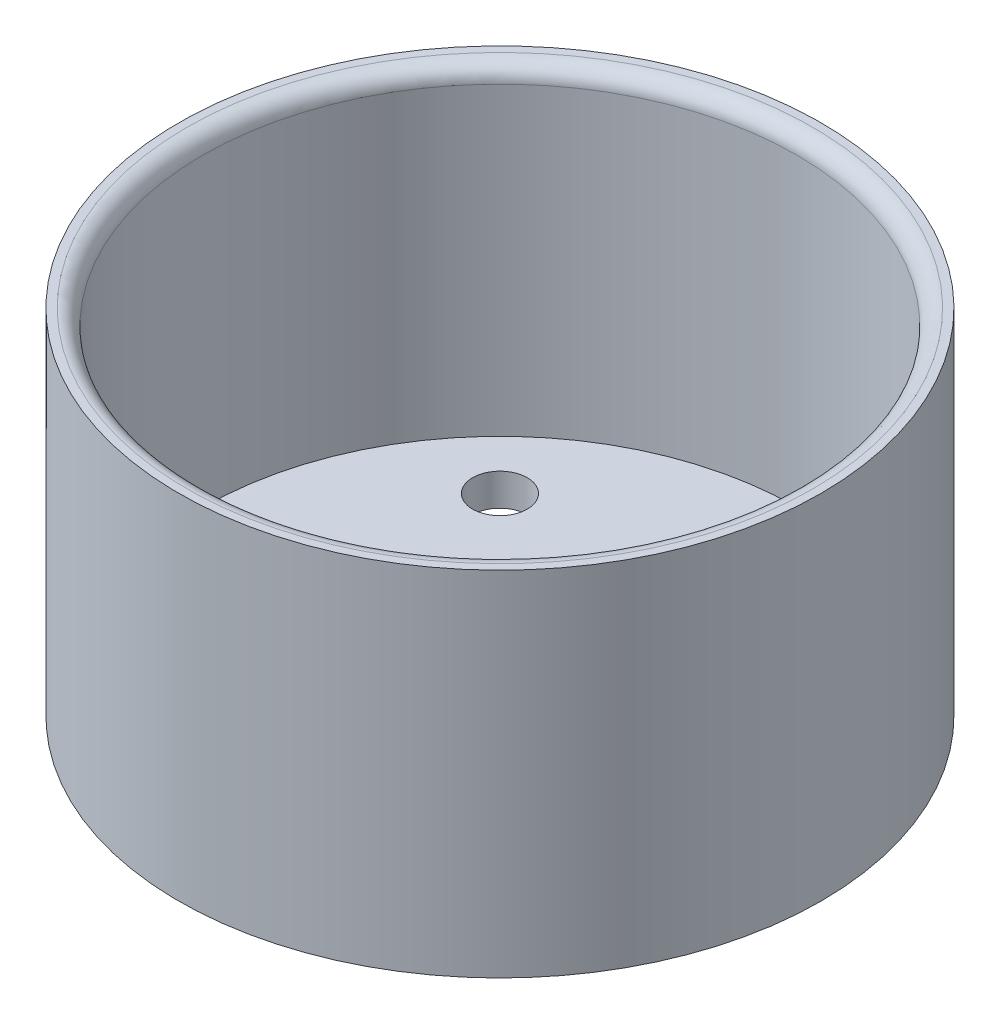
from build123d import *

# Parameters (mm, degrees)
CUT_EXTRUDE_1_DEPTH = 10


with BuildPart() as part:
    # 草图3 → 旋转1 (revolve)
    with BuildSketch(Plane.XY):
        with BuildLine():
            Line((0, 0), (0, 2))
            Line((0, 2), (18.5, 2))
            Line((18.5, 2), (18.5, 21))
            ThreePointArc((18.5, 21), (18.792893219, 21.707106781), (19.5, 22))
            Line((19.5, 22), (20, 22))
            Line((20, 22), (20, 2))
            Line((20, 2), (20, 1))
            Line((20, 1), (20, 0))
            Line((20, 0), (0, 0))
        make_face()
    revolve(axis=Axis((0, 0, 0), (0, 1, 0)))

    # 草图4 → 切除-拉伸1 (cut)
    with BuildSketch(Plane(origin=(0, 2, 0), x_dir=(1, 0, 0), z_dir=(0, 1, 0))):
        with BuildLine():
            ThreePointArc((10, -8.3), (8.797918472, -8.797918472), (8.3, -10))
            Line((8.3, -10), (10, -10))
            Line((10, -10), (10, -8.3))
        make_face()
        with BuildLine():
            Line((10, -10), (8.3, -10))
            ThreePointArc((8.3, -10), (10, -11.7), (11.7, -10))
            ThreePointArc((11.7, -10), (11.202081528, -8.797918472), (10, -8.3))
            Line((10, -8.3), (10, -10))
        make_face()
        with BuildLine():
            ThreePointArc((-10, -8.3), (-11.202081528, -11.202081528), (-8.3, -10))
            Line((-8.3, -10), (-10, -10))
            Line((-10, -10), (-10, -8.3))
        make_face()
        with BuildLine():
            Line((-10, -10), (-8.3, -10))
            ThreePointArc((-8.3, -10), (-8.797918472, -8.797918472), (-10, -8.3))
            Line((-10, -8.3), (-10, -10))
        make_face()
        with BuildLine():
            ThreePointArc((-8.3, 10), (-11.202081528, 11.202081528), (-10, 8.3))
            Line((-10, 8.3), (-10, 10))
            Line((-10, 10), (-8.3, 10))
        make_face()
        with BuildLine():
            Line((-10, 10), (-10, 8.3))
            ThreePointArc((-10, 8.3), (-8.797918472, 8.797918472), (-8.3, 10))
            Line((-8.3, 10), (-10, 10))
        make_face()
        with BuildLine():
            ThreePointArc((8.3, 10), (8.797918472, 8.797918472), (10, 8.3))
            Line((10, 8.3), (10, 10))
            Line((10, 10), (8.3, 10))
        make_face()
        with BuildLine():
            Line((10, 10), (10, 8.3))
            ThreePointArc((10, 8.3), (11.202081528, 8.797918472), (11.7, 10))
            ThreePointArc((11.7, 10), (10, 11.7), (8.3, 10))
            Line((8.3, 10), (10, 10))
        make_face()
    extrude(amount=-CUT_EXTRUDE_1_DEPTH, mode=Mode.SUBTRACT)


solid = part.part
